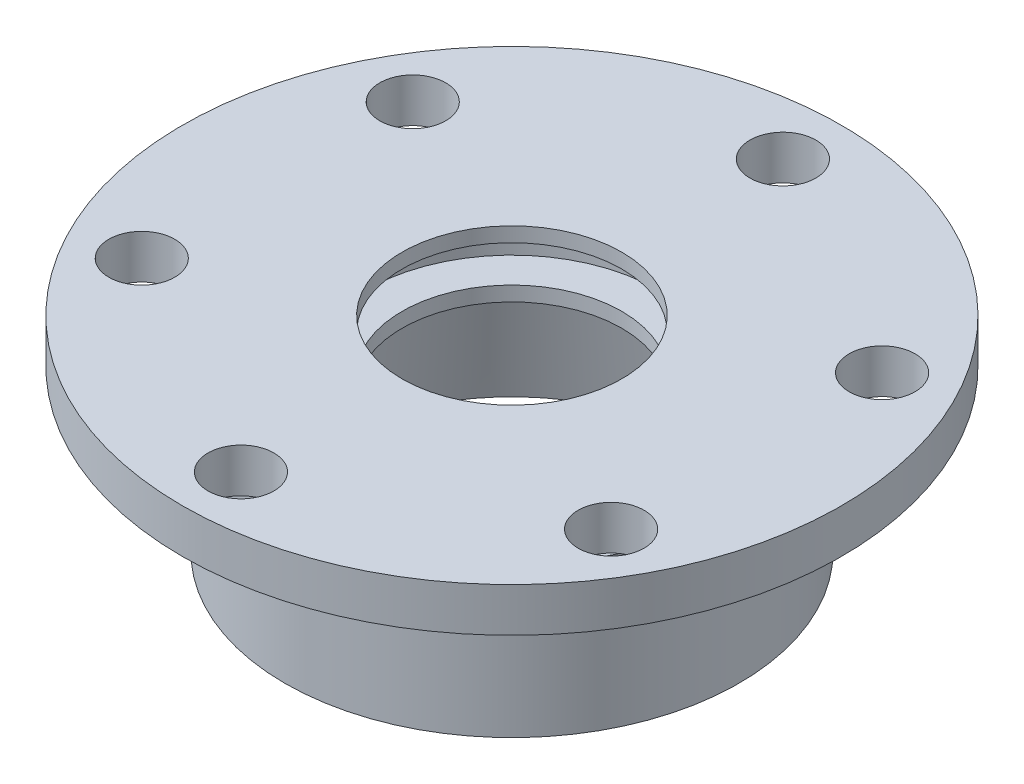
from build123d import *

# Parameters (mm, degrees)
CUT_EXTRUDE1_REACH = 71.527
SKETCH2_R          = 4.5


with BuildPart() as part:
    # Sketch1 → Revolve1 (revolve)
    with BuildSketch(Plane.XY, mode=Mode.PRIVATE) as revolve1_sk:
        Polygon((-45, 28), (-45, 22), (-29.5, 22), (-29.5, 20.5), (-31, 20.5), (-31, 0), (-26, 0), (-22.649787367, 19), (-15, 19), (-15, 21), (-20, 21), (-20, 26), (-15, 26), (-15, 28), (-29, 28), align=None)
    revolve(revolve1_sk.sketch.rotate(Axis((0, 30.618797564, 0), (0, -1, 0)), 270), axis=Axis((0, 30.618797564, 0), (0, -1, 0)))

    # Sketch2 → Cut-Extrude1 (cut, up to next)
    with BuildSketch(Plane(origin=(0, 28, 0), x_dir=(1, 0, 0), z_dir=(0, 1, 0)), mode=Mode.PRIVATE) as cut_extrude1_sk1:
        with Locations(Location((0, 37, 0), (0, 0, 270))):
            Circle(SKETCH2_R)
    cut_extrude1_tool1 = extrude(cut_extrude1_sk1.sketch, amount=-CUT_EXTRUDE1_REACH, mode=Mode.PRIVATE) & part.part
    # Sketch2 → Cut-Extrude1 (cut, up to next)
    with BuildSketch(Plane(origin=(0, 28, 0), x_dir=(1, 0, 0), z_dir=(0, 1, 0)), mode=Mode.PRIVATE) as cut_extrude1_sk2:
        with Locations(Location((32.04293994, 18.5, 0), (0, 0, 270))):
            Circle(SKETCH2_R)
    cut_extrude1_tool2 = extrude(cut_extrude1_sk2.sketch, amount=-CUT_EXTRUDE1_REACH, mode=Mode.PRIVATE) & part.part
    # Sketch2 → Cut-Extrude1 (cut, up to next)
    with BuildSketch(Plane(origin=(0, 28, 0), x_dir=(1, 0, 0), z_dir=(0, 1, 0)), mode=Mode.PRIVATE) as cut_extrude1_sk3:
        with Locations(Location((32.04293994, -18.5, 0), (0, 0, 270))):
            Circle(SKETCH2_R)
    cut_extrude1_tool3 = extrude(cut_extrude1_sk3.sketch, amount=-CUT_EXTRUDE1_REACH, mode=Mode.PRIVATE) & part.part
    # Sketch2 → Cut-Extrude1 (cut, up to next)
    with BuildSketch(Plane(origin=(0, 28, 0), x_dir=(1, 0, 0), z_dir=(0, 1, 0)), mode=Mode.PRIVATE) as cut_extrude1_sk4:
        with Locations(Location((0, -37, 0), (0, 0, 270))):
            Circle(SKETCH2_R)
    cut_extrude1_tool4 = extrude(cut_extrude1_sk4.sketch, amount=-CUT_EXTRUDE1_REACH, mode=Mode.PRIVATE) & part.part
    # Sketch2 → Cut-Extrude1 (cut, up to next)
    with BuildSketch(Plane(origin=(0, 28, 0), x_dir=(1, 0, 0), z_dir=(0, 1, 0)), mode=Mode.PRIVATE) as cut_extrude1_sk5:
        with Locations(Location((-32.04293994, -18.5, 0), (0, 0, 270))):
            Circle(SKETCH2_R)
    cut_extrude1_tool5 = extrude(cut_extrude1_sk5.sketch, amount=-CUT_EXTRUDE1_REACH, mode=Mode.PRIVATE) & part.part
    # Sketch2 → Cut-Extrude1 (cut, up to next)
    with BuildSketch(Plane(origin=(0, 28, 0), x_dir=(1, 0, 0), z_dir=(0, 1, 0)), mode=Mode.PRIVATE) as cut_extrude1_sk6:
        with Locations(Location((-32.04293994, 18.5, 0), (0, 0, 270))):
            Circle(SKETCH2_R)
    cut_extrude1_tool6 = extrude(cut_extrude1_sk6.sketch, amount=-CUT_EXTRUDE1_REACH, mode=Mode.PRIVATE) & part.part
    add(cut_extrude1_tool1.solids().sort_by_distance((0, 28, -37))[0], mode=Mode.SUBTRACT)
    add(cut_extrude1_tool2.solids().sort_by_distance((32.04294, 28, -18.5))[0], mode=Mode.SUBTRACT)
    add(cut_extrude1_tool3.solids().sort_by_distance((32.04294, 28, 18.5))[0], mode=Mode.SUBTRACT)
    add(cut_extrude1_tool4.solids().sort_by_distance((0, 28, 37))[0], mode=Mode.SUBTRACT)
    add(cut_extrude1_tool5.solids().sort_by_distance((-32.04294, 28, 18.5))[0], mode=Mode.SUBTRACT)
    add(cut_extrude1_tool6.solids().sort_by_distance((-32.04294, 28, -18.5))[0], mode=Mode.SUBTRACT)


solid = part.part
